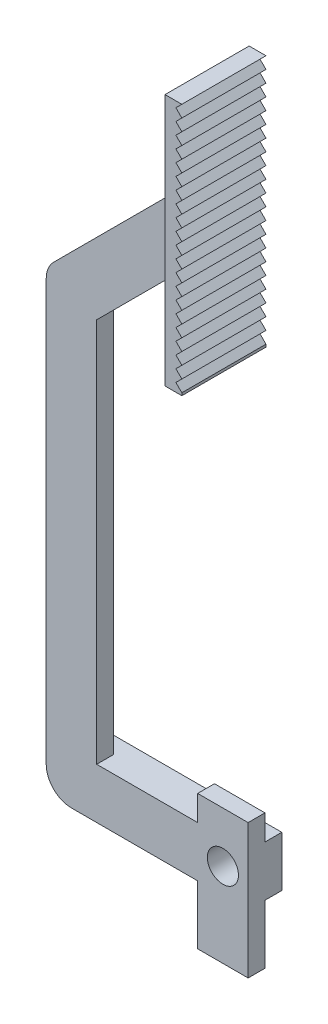
from build123d import *

# Parameters (mm, degrees)
SKETCH_1_R             = 1.85
EXTRUDE_1_DEPTH        = 2
CUT_EXTRUDE_START      = -4
SKETCH_4_W             = 6
SKETCH_4_H             = 3
SKETCH_4_H_2           = 7
CUT_EXTRUDE_2_DEPTH    = 2
EXTRUDE_2_DEPTH        = 2
SKETCH_5_W             = 10
SKETCH_5_H             = 30
EXTRUDE_3_DEPTH        = 2
CUT_EXTRUDE_3_DEPTH    = 10
PATTERN_LINEAR_1_COUNT = 21
PATTERN_LINEAR_1_PITCH = 1.414


with BuildPart() as part:
    # 草图1 → 凸台-拉伸1 (new, symmetric)
    with BuildSketch(Plane.XY):
        with BuildLine():
            Line((20, 6), (16, 6))
            Line((16, 6), (15, 6))
            Line((15, 6), (15, 3))
            Line((15, 3), (3, 3))
            Line((3, 3), (-3, 3))
            Line((-3, 3), (-3, 0))
            ThreePointArc((-3, 0), (-2.121320344, -2.121320344), (0, -3))
            Line((0, -3), (15, -3))
            Line((15, -3), (15, -10))
            Line((15, -10), (16, -10))
            Line((16, -10), (20, -10))
            Line((20, -10), (20.5, -10))
            Line((20.5, -10), (21, -10))
            Line((21, -10), (21, -3))
            Line((21, -3), (21, 3))
            Line((21, 3), (21, 6))
            Line((21, 6), (20, 6))
        make_face()
        with Locations((18, 0)):
            Circle(SKETCH_1_R, mode=Mode.SUBTRACT)
    extrude(amount=EXTRUDE_1_DEPTH, both=True)

    # 草图4 → 切除-拉伸2 (cut)
    with BuildSketch(Plane.XY.offset(2).offset(CUT_EXTRUDE_START)):
        with Locations((18, 4.5)):
            Rectangle(SKETCH_4_W, SKETCH_4_H)
        with Locations((18, -6.5)):
            Rectangle(SKETCH_4_W, SKETCH_4_H_2)
    extrude(amount=CUT_EXTRUDE_2_DEPTH, mode=Mode.SUBTRACT)

    # 草图1<3> → 凸台-拉伸2 (add)
    with BuildSketch(Plane.XY):
        with BuildLine():
            Line((-3, 3), (3, 3))
            Line((3, 3), (3, 48.757359313))
            Line((3, 48.757359313), (15.121320344, 60.878679656))
            Line((15.121320344, 60.878679656), (15.121320344, 69.363961031))
            Line((15.121320344, 69.363961031), (10.878679656, 65.121320344))
            Line((10.878679656, 65.121320344), (-2.121320344, 52.121320344))
            ThreePointArc((-2.121320344, 52.121320344), (-2.771638598, 51.148050297), (-3, 50))
            Line((-3, 50), (-3, 3))
        make_face()
    extrude(amount=EXTRUDE_2_DEPTH)

    # 草图5 → 凸台-拉伸3 (add)
    with BuildSketch(Plane(origin=(15.121320344, 0, 0), x_dir=(0, 0, -1), z_dir=(1, 0, 0))):
        with Locations((-1, 65)):
            Rectangle(SKETCH_5_W, SKETCH_5_H)
    extrude(amount=EXTRUDE_3_DEPTH)

    # 草图6 → 切除-拉伸3 (cut)
    with BuildSketch(Plane.XY.offset(6)):
        Polygon((17.121320344, 80), (16.414213562, 79.292893219), (17.121320344, 78.585786438), align=None)
    cut_extrude_3 = extrude(amount=-CUT_EXTRUDE_3_DEPTH, mode=Mode.SUBTRACT)

    # 阵列(线性)1: 切除-拉伸3 ×21
    with Locations(*[(0, -i * PATTERN_LINEAR_1_PITCH, 0) for i in range(1, PATTERN_LINEAR_1_COUNT)]):
        add(cut_extrude_3, mode=Mode.SUBTRACT)


solid = part.part
